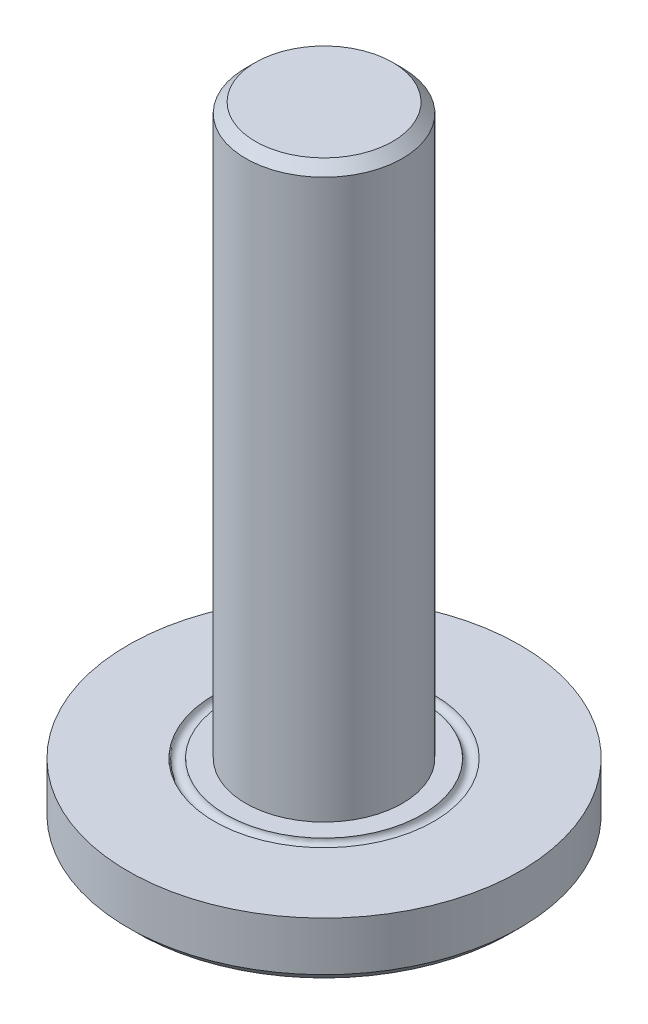
from build123d import *


with BuildPart() as part:
    # Esquisse1 → Base-Révolution (revolve)
    with BuildSketch(Plane(origin=(0, 0, 716.131939029), x_dir=(-1, 0, 0), z_dir=(0, 0, -1)), mode=Mode.PRIVATE) as base_r_volution_sk:
        with BuildLine():
            Line((-2169.949576888, 588.734614361), (-2160.449576888, 588.734614361))
            Line((-2160.449576888, 588.734614361), (-2160.449576888, 620.734614361))
            Line((-2160.449576888, 620.734614361), (-2163.949576888, 620.734614361))
            Line((-2163.949576888, 620.734614361), (-2164.449576888, 620.234614361))
            Line((-2164.449576888, 620.234614361), (-2164.449576888, 605.534359442))
            Line((-2164.449576888, 605.534359442), (-2164.449576888, 591.734359161))
            Line((-2164.449576888, 591.734359161), (-2165.449576888, 591.734359161))
            ThreePointArc((-2165.449576888, 591.734359161), (-2165.749653787, 591.434359171), (-2166.049576849, 591.734512958))
            Line((-2166.049576849, 591.734512958), (-2170.449576888, 591.734512958))
            Line((-2170.449576888, 591.734512958), (-2170.449576888, 589.234614361))
            Line((-2170.449576888, 589.234614361), (-2169.949576888, 588.734614361))
        make_face()
    revolve(base_r_volution_sk.sketch.rotate(Axis((2160.449576888, 588.734614361, 716.131939029), (0, 1, 0)), 90), axis=Axis((2160.449576888, 588.734614361, 716.131939029), (0, 1, 0)))


solid = part.part
